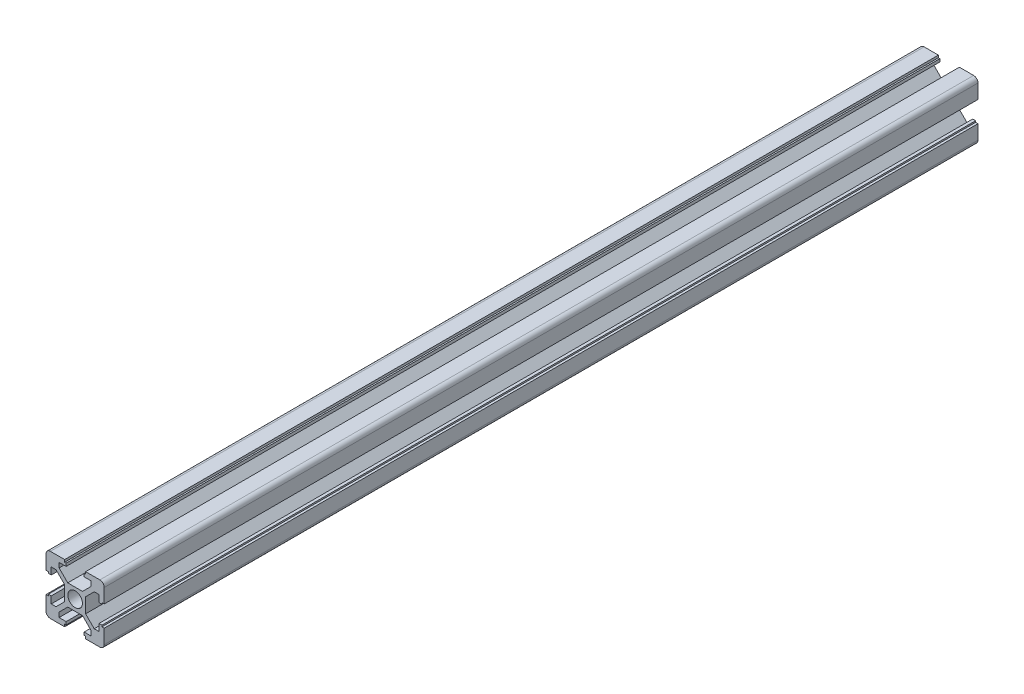
from build123d import *

# Parameters (mm, degrees)
SKETCH_1_R          = 2.5
EXTRUDE_1_DEPTH     = 300
SKETCH_2_R          = 1.75
CUT_EXTRUDE_1_DEPTH = 39


with BuildPart() as part:
    # 草图1 → 凸台-拉伸1 (new body)
    with BuildSketch(Plane.XY):
        with BuildLine():
            Line((-4.415608984, 3.873972711), (-4.415608984, -1.204706946))
            Line((-4.415608984, -1.204706946), (-7.376269156, -4.165367117))
            Line((-7.376269156, -4.165367117), (-9.015608984, -4.165367117))
            Line((-9.015608984, -4.165367117), (-9.015608984, -1.765367117))
            Line((-9.015608984, -1.765367117), (-10.015608984, -1.765367117))
            Line((-10.015608984, -1.765367117), (-10.015608984, -2.265367117))
            Line((-10.015608984, -2.265367117), (-10.815608984, -2.265367117))
            Line((-10.815608984, -2.265367117), (-10.815608984, -7.165367117))
            ThreePointArc((-10.815608984, -7.165367117), (-10.376269156, -8.226027289), (-9.315608984, -8.665367117))
            Line((-9.315608984, -8.665367117), (-4.415608984, -8.665367117))
            Line((-4.415608984, -8.665367117), (-4.415608984, -7.865367117))
            Line((-4.415608984, -7.865367117), (-3.915608984, -7.865367117))
            Line((-3.915608984, -7.865367117), (-3.915608984, -6.865367117))
            Line((-3.915608984, -6.865367117), (-6.315608984, -6.865367117))
            Line((-6.315608984, -6.865367117), (-6.315608984, -5.226027289))
            Line((-6.315608984, -5.226027289), (-3.354948812, -2.265367117))
            Line((-3.354948812, -2.265367117), (1.723730844, -2.265367117))
            Line((1.723730844, -2.265367117), (4.684391016, -5.226027289))
            Line((4.684391016, -5.226027289), (4.684391016, -6.865367117))
            Line((4.684391016, -6.865367117), (2.284391016, -6.865367117))
            Line((2.284391016, -6.865367117), (2.284391016, -7.865367117))
            Line((2.284391016, -7.865367117), (2.784391016, -7.865367117))
            Line((2.784391016, -7.865367117), (2.784391016, -8.665367117))
            Line((2.784391016, -8.665367117), (7.684391016, -8.665367117))
            ThreePointArc((7.684391016, -8.665367117), (8.745051188, -8.226027289), (9.184391016, -7.165367117))
            Line((9.184391016, -7.165367117), (9.184391016, -2.265367117))
            Line((9.184391016, -2.265367117), (8.384391016, -2.265367117))
            Line((8.384391016, -2.265367117), (8.384391016, -1.765367117))
            Line((8.384391016, -1.765367117), (7.384391016, -1.765367117))
            Line((7.384391016, -1.765367117), (7.384391016, -4.165367117))
            Line((7.384391016, -4.165367117), (5.745051188, -4.165367117))
            Line((5.745051188, -4.165367117), (2.784391016, -1.204706946))
            Line((2.784391016, -1.204706946), (2.784391016, 3.873972711))
            Line((2.784391016, 3.873972711), (5.745051188, 6.834632883))
            Line((5.745051188, 6.834632883), (7.384391016, 6.834632883))
            Line((7.384391016, 6.834632883), (7.384391016, 4.434632883))
            Line((7.384391016, 4.434632883), (8.384391016, 4.434632883))
            Line((8.384391016, 4.434632883), (8.384391016, 4.934632883))
            Line((8.384391016, 4.934632883), (9.184391016, 4.934632883))
            Line((9.184391016, 4.934632883), (9.184391016, 9.834632883))
            ThreePointArc((9.184391016, 9.834632883), (8.745051188, 10.895293054), (7.684391016, 11.334632883))
            Line((7.684391016, 11.334632883), (2.784391016, 11.334632883))
            Line((2.784391016, 11.334632883), (2.784391016, 10.534632883))
            Line((2.784391016, 10.534632883), (2.284391016, 10.534632883))
            Line((2.284391016, 10.534632883), (2.284391016, 9.534632883))
            Line((2.284391016, 9.534632883), (4.684391016, 9.534632883))
            Line((4.684391016, 9.534632883), (4.684391016, 7.895293054))
            Line((4.684391016, 7.895293054), (1.723730844, 4.934632883))
            Line((1.723730844, 4.934632883), (-3.354948812, 4.934632883))
            Line((-3.354948812, 4.934632883), (-6.315608984, 7.895293054))
            Line((-6.315608984, 7.895293054), (-6.315608984, 9.534632883))
            Line((-6.315608984, 9.534632883), (-3.915608984, 9.534632883))
            Line((-3.915608984, 9.534632883), (-3.915608984, 10.534632883))
            Line((-3.915608984, 10.534632883), (-4.415608984, 10.534632883))
            Line((-4.415608984, 10.534632883), (-4.415608984, 11.334632883))
            Line((-4.415608984, 11.334632883), (-9.315608984, 11.334632883))
            ThreePointArc((-9.315608984, 11.334632883), (-10.376269156, 10.895293054), (-10.815608984, 9.834632883))
            Line((-10.815608984, 9.834632883), (-10.815608984, 4.934632883))
            Line((-10.815608984, 4.934632883), (-10.015608984, 4.934632883))
            Line((-10.015608984, 4.934632883), (-10.015608984, 4.434632883))
            Line((-10.015608984, 4.434632883), (-9.015608984, 4.434632883))
            Line((-9.015608984, 4.434632883), (-9.015608984, 6.834632883))
            Line((-9.015608984, 6.834632883), (-7.376269156, 6.834632883))
            Line((-7.376269156, 6.834632883), (-4.415608984, 3.873972711))
        make_face()
        with Locations((-0.815608984, 1.334632883)):
            Circle(SKETCH_1_R, mode=Mode.SUBTRACT)
    extrude(amount=EXTRUDE_1_DEPTH)

    # 草图2 → 切除-拉伸1 (cut)
    with BuildSketch(Plane(origin=(2.784391016, 0, 0), x_dir=(0, 0, -1), z_dir=(1, 0, 0))):
        with Locations(Location((-250, 1.334632883, 0), (0, 0, 90))):
            Circle(SKETCH_2_R)
        with Locations(Location((-50, 1.334632883, 0), (0, 0, 90))):
            Circle(SKETCH_2_R)
    extrude(amount=-CUT_EXTRUDE_1_DEPTH, mode=Mode.SUBTRACT)


solid = part.part
